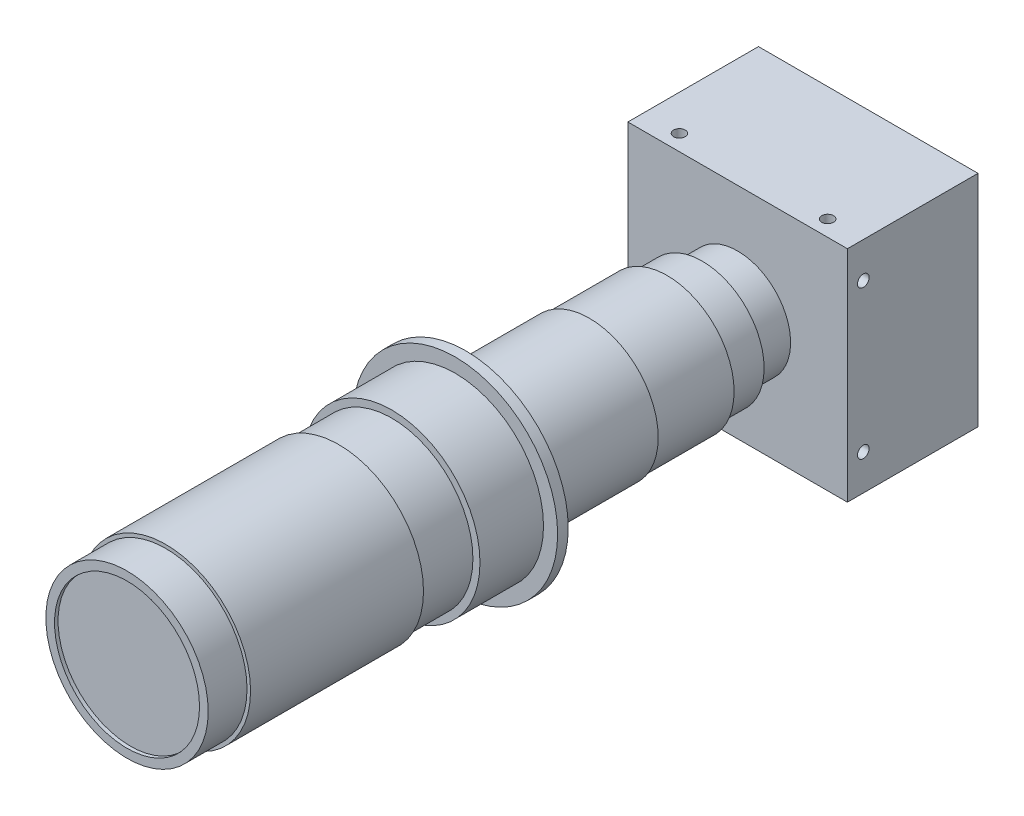
from build123d import *

# Parameters (mm, degrees)
SKETCH_1_W             = 62.2
SKETCH_1_H             = 62.2
EXTRUDE_1_DEPTH        = 37
SKETCH_2_R             = 15
EXTRUDE_2_DEPTH        = 10
SKETCH_3_R             = 17.5
EXTRUDE_3_DEPTH        = 10
SKETCH_4_R             = 19
EXTRUDE_4_DEPTH        = 22
SKETCH_5_R             = 19.5
EXTRUDE_5_DEPTH        = 35
SKETCH_6_R             = 29
EXTRUDE_6_DEPTH        = 3
SKETCH_7_R             = 25
EXTRUDE_7_DEPTH        = 18
SKETCH_9_R             = 4.987570285
SKETCH_9_R_2           = 3.46960963
EXTRUDE_8_DEPTH        = 7
SKETCH_10_W            = 8.223130645
SKETCH_10_H            = 5.124180357
CUT_EXTRUDE_2_DEPTH    = 3
HOLE_WIZARD_M4_1_D     = 3.3
HOLE_WIZARD_M4_1_DEPTH = 10.1
HOLE_WIZARD_M4_1_TIP   = 0.991420021
HOLE_WIZARD_M4_2_D     = 3.3
HOLE_WIZARD_M4_2_DEPTH = 10.1
HOLE_WIZARD_M4_2_TIP   = 0.991420021
HOLE_WIZARD_M4_3_D     = 3.3
HOLE_WIZARD_M4_3_DEPTH = 10.1
HOLE_WIZARD_M4_3_TIP   = 0.991420021
HOLE_WIZARD_M4_4_D     = 3.3
HOLE_WIZARD_M4_4_DEPTH = 10.1
HOLE_WIZARD_M4_4_TIP   = 0.991420021
SKETCH_8_R             = 23
EXTRUDE_9_DEPTH        = 15
SKETCH_19_R            = 24
EXTRUDE_10_DEPTH       = 49
SKETCH_20_R            = 23
EXTRUDE_11_DEPTH       = 11
SKETCH_21_R            = 20.537858868
CUT_EXTRUDE_3_DEPTH    = 1


with BuildPart() as part:
    # 草图1 → 凸台-拉伸1 (new body)
    with BuildSketch(Plane.XY):
        with Locations((31.1, 31.1)):
            Rectangle(SKETCH_1_W, SKETCH_1_H)
    extrude(amount=EXTRUDE_1_DEPTH)

    # 草图2 → 凸台-拉伸2 (add)
    with BuildSketch(Plane.XY.offset(37)):
        with Locations(Location((31.1, 31.1, 0), (0, 0, 180))):
            Circle(SKETCH_2_R)
    extrude(amount=EXTRUDE_2_DEPTH)

    # 草图3 → 凸台-拉伸3 (add)
    with BuildSketch(Plane.XY.offset(47)):
        with Locations((31.1, 31.1)):
            Circle(SKETCH_3_R)
    extrude(amount=EXTRUDE_3_DEPTH)

    # 草图4 → 凸台-拉伸4 (add)
    with BuildSketch(Plane.XY.offset(57)):
        with Locations((31.1, 31.1)):
            Circle(SKETCH_4_R)
    extrude(amount=EXTRUDE_4_DEPTH)

    # 草图5 → 凸台-拉伸5 (add)
    with BuildSketch(Plane.XY.offset(79)):
        with Locations((31.1, 31.1)):
            Circle(SKETCH_5_R)
    extrude(amount=EXTRUDE_5_DEPTH)

    # 草图6 → 凸台-拉伸6 (add)
    with BuildSketch(Plane.XY.offset(114)):
        with Locations((31.1, 31.1)):
            Circle(SKETCH_6_R)
    extrude(amount=EXTRUDE_6_DEPTH)

    # 草图7 → 凸台-拉伸7 (add)
    with BuildSketch(Plane.XY.offset(117)):
        with Locations((31.1, 31.1)):
            Circle(SKETCH_7_R)
    extrude(amount=EXTRUDE_7_DEPTH)

    # 草图9 → 凸台-拉伸8 (add)
    with BuildSketch(Plane(origin=(0, 0, 0), x_dir=(-1, 0, 0), z_dir=(0, 0, -1))):
        with Locations((-16.576254003, 47.30330958)):
            Circle(SKETCH_9_R)
        with Locations((-16.576254003, 47.30330958)):
            Circle(SKETCH_9_R_2, mode=Mode.SUBTRACT)
    extrude(amount=EXTRUDE_8_DEPTH)

    # 草图10 → 切除-拉伸2 (cut)
    with BuildSketch(Plane(origin=(0, 0, 0), x_dir=(-1, 0, 0), z_dir=(0, 0, -1))):
        with Locations((-20.516916702, 15.688590304)):
            Rectangle(SKETCH_10_W, SKETCH_10_H)
    extrude(amount=-CUT_EXTRUDE_2_DEPTH, mode=Mode.SUBTRACT)

    # M4 螺纹孔1
    with Locations(Plane(origin=(0, 62.2, 0), x_dir=(-1, 0, 0), z_dir=(0, 1, 0))):
        with Locations((-10.1, 32.5), (-52.1, 32.5)):
            Hole(HOLE_WIZARD_M4_1_D / 2, depth=HOLE_WIZARD_M4_1_DEPTH)
            with Locations((0, 0, -(HOLE_WIZARD_M4_1_DEPTH + HOLE_WIZARD_M4_1_TIP / 2))):  # 118° drill point
                Cone(0, HOLE_WIZARD_M4_1_D / 2, HOLE_WIZARD_M4_1_TIP, mode=Mode.SUBTRACT)

    # M4 螺纹孔2
    with Locations(Plane(origin=(62.2, 0, 0), x_dir=(0, 0, -1), z_dir=(1, 0, 0))):
        with Locations((-32.5, 10.1), (-32.5, 52.1)):
            Hole(HOLE_WIZARD_M4_2_D / 2, depth=HOLE_WIZARD_M4_2_DEPTH)
            with Locations((0, 0, -(HOLE_WIZARD_M4_2_DEPTH + HOLE_WIZARD_M4_2_TIP / 2))):  # 118° drill point
                Cone(0, HOLE_WIZARD_M4_2_D / 2, HOLE_WIZARD_M4_2_TIP, mode=Mode.SUBTRACT)

    # M4 螺纹孔3
    with Locations(Plane.XZ):
        with Locations((10.1, 32.5), (52.1, 32.5)):
            Hole(HOLE_WIZARD_M4_3_D / 2, depth=HOLE_WIZARD_M4_3_DEPTH)
            with Locations((0, 0, -(HOLE_WIZARD_M4_3_DEPTH + HOLE_WIZARD_M4_3_TIP / 2))):  # 118° drill point
                Cone(0, HOLE_WIZARD_M4_3_D / 2, HOLE_WIZARD_M4_3_TIP, mode=Mode.SUBTRACT)

    # M4 螺纹孔4
    with Locations(Plane.ZY):
        with Locations((32.5, 52.1), (32.5, 10.1)):
            Hole(HOLE_WIZARD_M4_4_D / 2, depth=HOLE_WIZARD_M4_4_DEPTH)
            with Locations((0, 0, -(HOLE_WIZARD_M4_4_DEPTH + HOLE_WIZARD_M4_4_TIP / 2))):  # 118° drill point
                Cone(0, HOLE_WIZARD_M4_4_D / 2, HOLE_WIZARD_M4_4_TIP, mode=Mode.SUBTRACT)


with BuildPart() as body_2:
    # 草图8 → 凸台-拉伸9 (new body)
    with BuildSketch(Plane.XY.offset(135)):
        with Locations((31.1, 31.1)):
            Circle(SKETCH_8_R)
    extrude(amount=EXTRUDE_9_DEPTH)


with BuildPart() as body_3:
    # 草图19 → 凸台-拉伸10 (new body)
    with BuildSketch(Plane.XY.offset(150)):
        with Locations((31.1, 31.1)):
            Circle(SKETCH_19_R)
    extrude(amount=EXTRUDE_10_DEPTH)

    # 草图20 → 凸台-拉伸11 (add)
    with BuildSketch(Plane.XY.offset(199)):
        with Locations((31.1, 31.1)):
            Circle(SKETCH_20_R)
    extrude(amount=EXTRUDE_11_DEPTH)

    # 草图21 → 切除-拉伸3 (cut)
    with BuildSketch(Plane.XY.offset(210)):
        with Locations((31.1, 31.1)):
            Circle(SKETCH_21_R)
    extrude(amount=-CUT_EXTRUDE_3_DEPTH, mode=Mode.SUBTRACT)


solid = Compound([part.part, body_2.part, body_3.part])
